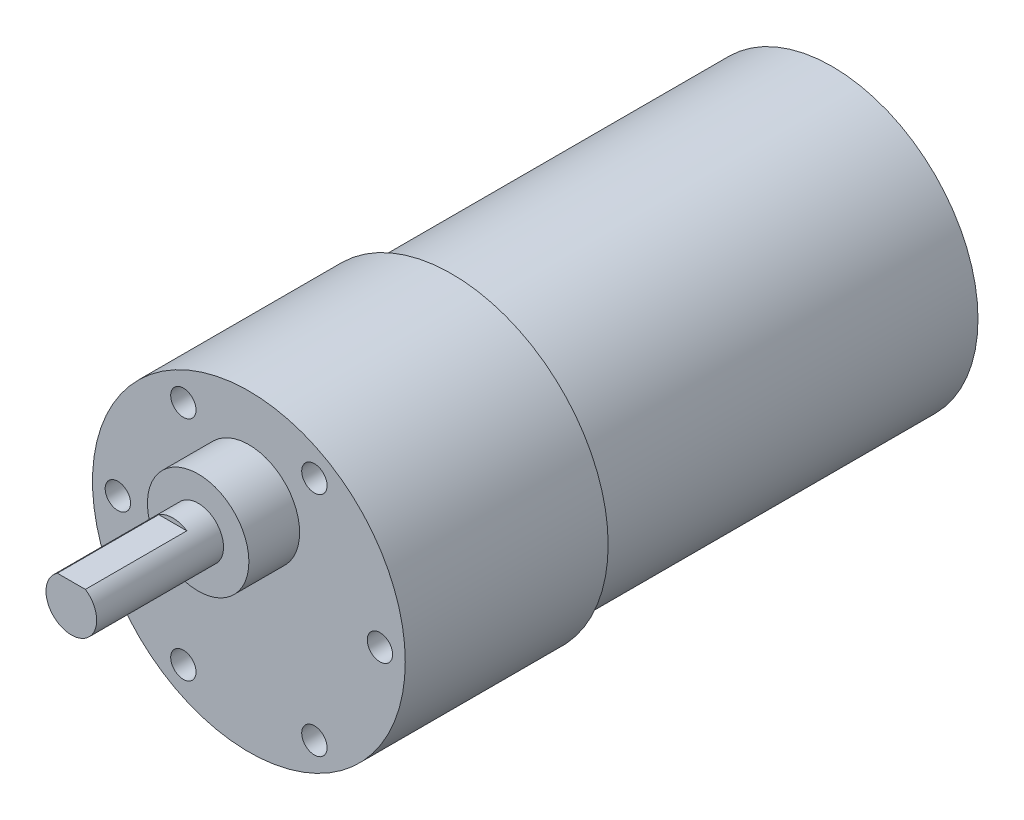
from build123d import *

# Parameters (mm, degrees)
SKETCH1_R           = 18.5
BOSS_EXTRUDE1_DEPTH = 24
SKETCH2_R           = 17.25
BOSS_EXTRUDE2_DEPTH = 45
SKETCH3_R           = 6
BOSS_EXTRUDE3_DEPTH = 6
SKETCH4_R           = 3
BOSS_EXTRUDE4_DEPTH = 15
CUT_EXTRUDE1_START  = -12
CUT_EXTRUDE1_DEPTH  = 12
SKETCH6_R           = 1.5
CUT_EXTRUDE2_DEPTH  = 3


with BuildPart() as part:
    # Sketch1 → Boss-Extrude1 (new body)
    with BuildSketch(Plane.XY):
        Circle(SKETCH1_R)
    extrude(amount=BOSS_EXTRUDE1_DEPTH)

    # Sketch2 → Boss-Extrude2 (add)
    with BuildSketch(Plane(origin=(0, 0, 0), x_dir=(-1, 0, 0), z_dir=(0, 0, -1))):
        with Locations(Location((0, 0, 0), (0, 0, 180))):
            Circle(SKETCH2_R)
    extrude(amount=BOSS_EXTRUDE2_DEPTH)

    # Sketch3 → Boss-Extrude3 (add)
    with BuildSketch(Plane.XY.offset(24)):
        with Locations((0, 7)):
            Circle(SKETCH3_R)
    extrude(amount=BOSS_EXTRUDE3_DEPTH)

    # Sketch4 → Boss-Extrude4 (add)
    with BuildSketch(Plane.XY.offset(30)):
        with Locations((0, 7)):
            Circle(SKETCH4_R)
    extrude(amount=BOSS_EXTRUDE4_DEPTH)

    # Sketch5 → Cut-Extrude1 (cut)
    with BuildSketch(Plane.XY.offset(45).offset(CUT_EXTRUDE1_START)):
        with BuildLine():
            ThreePointArc((1.658312395, 9.5), (0, 10), (-1.658312395, 9.5))
            Line((-1.658312395, 9.5), (0, 9.5))
            Line((0, 9.5), (1.658312395, 9.5))
        make_face()
    extrude(amount=CUT_EXTRUDE1_DEPTH, mode=Mode.SUBTRACT)

    # Sketch6 → Cut-Extrude2 (cut)
    with BuildSketch(Plane.XY.offset(24)):
        with Locations((7.75, 13.423393759)):
            Circle(SKETCH6_R)
        with Locations((15.5, 0)):
            Circle(SKETCH6_R)
        with Locations((7.75, -13.423393759)):
            Circle(SKETCH6_R)
        with Locations((-7.75, -13.423393759)):
            Circle(SKETCH6_R)
        with Locations((-15.5, 0)):
            Circle(SKETCH6_R)
        with Locations((-7.75, 13.423393759)):
            Circle(SKETCH6_R)
    extrude(amount=-CUT_EXTRUDE2_DEPTH, mode=Mode.SUBTRACT)


solid = part.part
